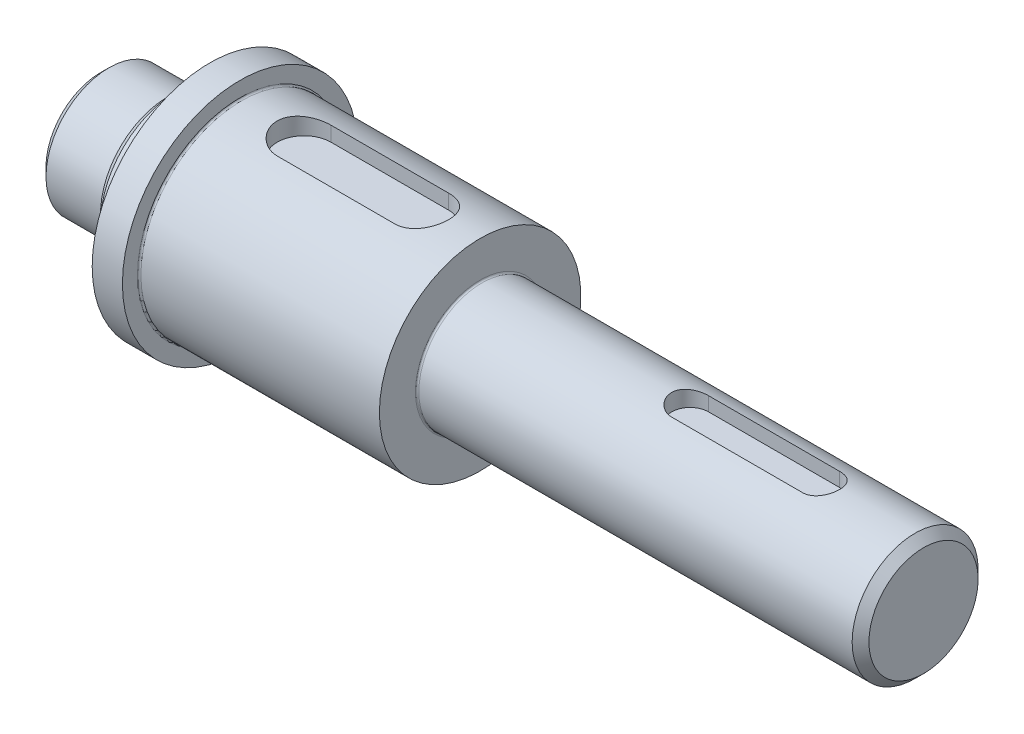
from build123d import *

# Parameters (mm, degrees)
CUT_EXTRUDE_1_DEPTH      = 11
CUT_EXTRUDE_2_DEPTH      = 359.209373116
CUT_EXTRUDE_2_DEPTH_BACK = 1
CHAMFER_1_SIZE           = 5
FILLET_1_R               = 1


with BuildPart() as part:
    # 草图1 → 旋转1 (revolve)
    with BuildSketch(Plane.XY, mode=Mode.PRIVATE) as revolve_1_sk:
        Polygon((-152.788338001, 0), (-152.788338001, 37.5), (-112.788338001, 37.5), (-112.788338001, 45), (-87.788338001, 45), (-87.788338001, 70), (-69.788338001, 70), (-69.788338001, 60), (73.211661999, 60), (73.211661999, 37.5), (337.211661999, 37.5), (337.211661999, 0), align=None)
    revolve(revolve_1_sk.sketch.rotate(Axis((-105.28115942, 0, 0), (1, 0, 0)), 90), axis=Axis((-105.28115942, 0, 0), (1, 0, 0)))

    # 草图2 → 切除-拉伸1 (cut)
    with BuildSketch(Plane(origin=(0, 60, 0), x_dir=(-1, 0, 0), z_dir=(0, 1, 0))):
        with BuildLine():
            Line((-38.211661999, 15.832796851), (31.788338001, 15.832796851))
            ThreePointArc((31.788338001, 15.832796851), (47.788338001, -0.167203149), (31.788338001, -16.167203149))
            Line((31.788338001, -16.167203149), (-38.211661999, -16.167203149))
            ThreePointArc((-38.211661999, -16.167203149), (-54.211661999, -0.167203149), (-38.211661999, 15.832796851))
        make_face()
    extrude(amount=-CUT_EXTRUDE_1_DEPTH, mode=Mode.SUBTRACT)

    # 草图3 → 切除-拉伸2 (cut, two sides: drawn at the far end of the back side and taken through both)
    with BuildSketch(Plane(origin=(0, 28.5, 0), x_dir=(-1, 0, 0), z_dir=(0, 1, 0)).offset(-CUT_EXTRUDE_2_DEPTH_BACK)):
        with BuildLine():
            Line((-198.211661999, 11), (-276.211661999, 11))
            ThreePointArc((-276.211661999, 11), (-287.227527816, -0.015865818), (-276.211661999, -11.031731635))
            Line((-276.211661999, -11.031731635), (-198.211661999, -11.031731635))
            ThreePointArc((-198.211661999, -11.031731635), (-187.195796181, -0.015865818), (-198.211661999, 11))
        make_face()
    extrude(amount=CUT_EXTRUDE_2_DEPTH + CUT_EXTRUDE_2_DEPTH_BACK, mode=Mode.SUBTRACT)

    # 倒角1
    chamfer_1_edges = [part.edges().sort_by_distance(p)[0] for p in [
        (-112.788338001, 0, -45),
        (-152.788338001, 0, -37.5),
        (337.211661999, 0, -37.5),
    ]]
    chamfer(chamfer_1_edges, length=CHAMFER_1_SIZE)

    # 圆角1
    fillet_1_edges = [part.edges().sort_by_distance(p)[0] for p in [
        (-69.788338001, 0, -60),
        (-87.788338001, 0, -45),
        (73.211661999, 0, -37.5),
    ]]
    fillet(fillet_1_edges, radius=FILLET_1_R)


solid = part.part
